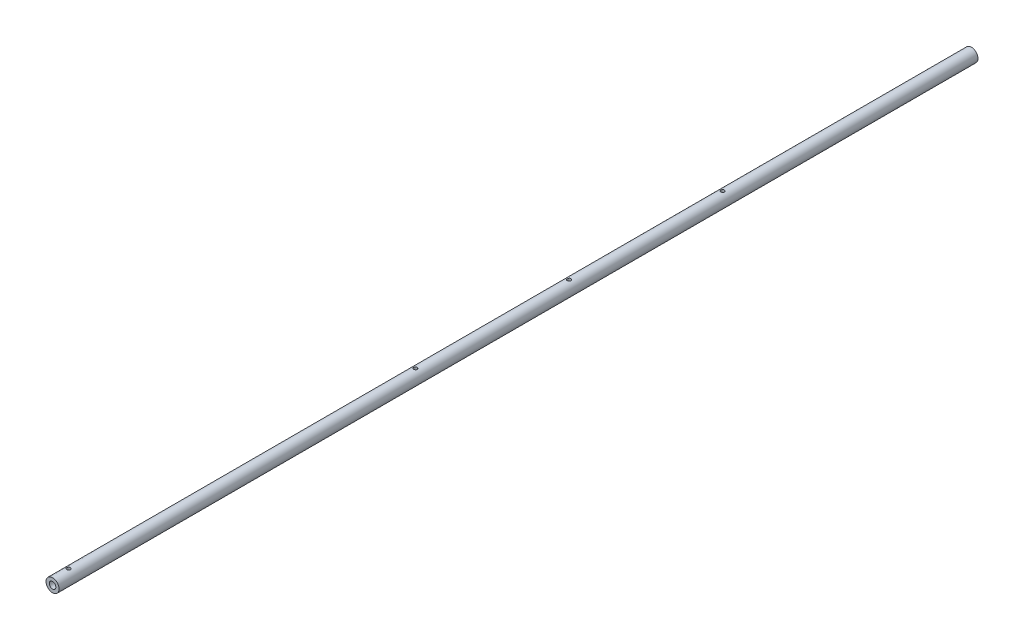
from build123d import *

# Parameters (mm, degrees)
SKETCH1_R        = 7.8613
SKETCH1_R_2      = 3.93065
ROD_DEPTH        = 1101.725
HOLES_DEPTH      = 1102.781092459
HOLES_DEPTH_BACK = 1102.781092459
SKETCH3_R        = 2.1082


with BuildPart() as part:
    # Sketch1 → Rod (new body)
    with BuildSketch(Plane.XY):
        with Locations(Location((0, 0, 0), (0, 0, 180))):
            Circle(SKETCH1_R)
        with Locations(Location((0, 0, 0), (0, 0, 180))):
            Circle(SKETCH1_R_2, mode=Mode.SUBTRACT)
    extrude(amount=ROD_DEPTH)

    # Sketch3 → Holes (cut, two sides: drawn at the far end of the back side and taken through both)
    with BuildSketch(Plane(origin=(0, 0, 0), x_dir=(1, 0, 0), z_dir=(0, 1, 0)).offset(-HOLES_DEPTH_BACK)):
        with Locations(Location((0, -298.45, 0), (0, 0, 270))):
            Circle(SKETCH3_R)
        with Locations(Location((0, -482.6, 0), (0, 0, 270))):
            Circle(SKETCH3_R)
        with Locations(Location((0, -666.75, 0), (0, 0, 270))):
            Circle(SKETCH3_R)
        with Locations(Location((0, -1082.675, 0), (0, 0, 270))):
            Circle(SKETCH3_R)
    extrude(amount=HOLES_DEPTH + HOLES_DEPTH_BACK, mode=Mode.SUBTRACT)


solid = part.part
